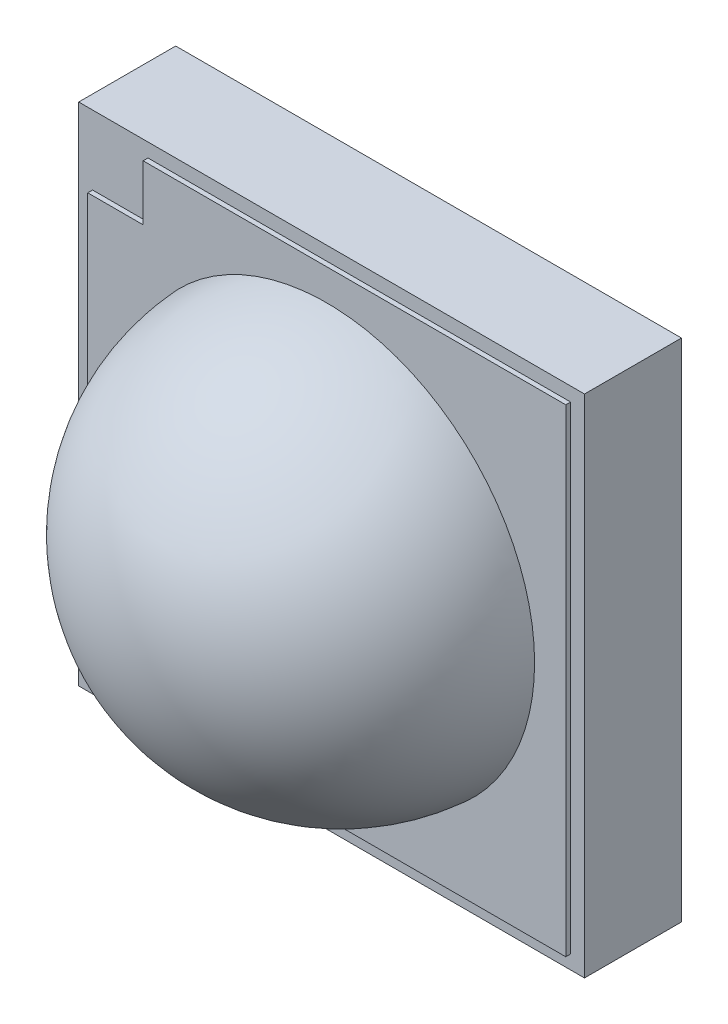
from build123d import *

# Parameters (mm, degrees)
EXTRUDE_1_DEPTH   = 0.035
SKETCH_1_W        = 0.53
SKETCH_1_H        = 0.75
EXTRUDE_1_2_DEPTH = 0.035
EXTRUDE_1_3_DEPTH = 0.035
EXTRUDE_1_4_DEPTH = 0.035
EXTRUDE_1_5_DEPTH = 0.035
EXTRUDE_1_6_DEPTH = 0.035
EXTRUDE_1_7_DEPTH = 0.035
SKETCH_2_W        = 3.65
SKETCH_2_H        = 3.65
EXTRUDE_2_DEPTH   = 0.7
EXTRUDE_3_DEPTH   = 0.035


with BuildPart() as part:
    # Эскиз1 → Бобышка-Вытянуть1 (new body)
    with BuildSketch(Plane.XY):
        Polygon((0.725, -1.625), (-0.525, -1.625), (-0.725, -1.425), (-0.725, 1.625), (0.725, 1.625), align=None)
    extrude(amount=EXTRUDE_1_DEPTH)



with BuildPart() as body_2:
    # Эскиз1 → Extrude 1 2 (new body)
    with BuildSketch(Plane.XY):
        with Locations((1.37, -1.25)):
            Rectangle(SKETCH_1_W, SKETCH_1_H)
    extrude(amount=EXTRUDE_1_2_DEPTH)


with BuildPart() as body_3:
    # Эскиз1 → Extrude 1 3 (new body)
    with BuildSketch(Plane.XY):
        with Locations((-1.37, -1.25)):
            Rectangle(SKETCH_1_W, SKETCH_1_H)
    extrude(amount=EXTRUDE_1_3_DEPTH)


with BuildPart() as body_4:
    # Эскиз1 → Extrude 1 4 (new body)
    with BuildSketch(Plane.XY):
        with Locations((1.37, 0)):
            Rectangle(SKETCH_1_W, SKETCH_1_H)
    extrude(amount=EXTRUDE_1_4_DEPTH)


with BuildPart() as body_5:
    # Эскиз1 → Extrude 1 5 (new body)
    with BuildSketch(Plane.XY):
        with Locations((1.37, 1.25)):
            Rectangle(SKETCH_1_W, SKETCH_1_H)
    extrude(amount=EXTRUDE_1_5_DEPTH)


with BuildPart() as body_6:
    # Эскиз1 → Extrude 1 6 (new body)
    with BuildSketch(Plane.XY):
        with Locations((-1.37, 0)):
            Rectangle(SKETCH_1_W, SKETCH_1_H)
    extrude(amount=EXTRUDE_1_6_DEPTH)


with BuildPart() as body_7:
    # Эскиз1 → Extrude 1 7 (new body)
    with BuildSketch(Plane.XY):
        with Locations((-1.37, 1.25)):
            Rectangle(SKETCH_1_W, SKETCH_1_H)
    extrude(amount=EXTRUDE_1_7_DEPTH)


with BuildPart() as part_1:
    add(part.part)

    add(body_2.part)  # Бобышка-Вытянуть2 merges body 2

    add(body_3.part)  # Бобышка-Вытянуть2 merges body 3

    add(body_4.part)  # Бобышка-Вытянуть2 merges body 4

    add(body_5.part)  # Бобышка-Вытянуть2 merges body 5

    add(body_6.part)  # Бобышка-Вытянуть2 merges body 6

    add(body_7.part)  # Бобышка-Вытянуть2 merges body 7
    # Эскиз2 → Бобышка-Вытянуть2 (add)
    with BuildSketch(Plane.XY.offset(0.035)):
        Rectangle(SKETCH_2_W, SKETCH_2_H)
    extrude(amount=EXTRUDE_2_DEPTH)

    # Эскиз4 → Бобышка-Вытянуть3 (add)
    with BuildSketch(Plane.XY.offset(0.735)):
        Polygon((1.725, 1.725), (1.725, -1.725), (-1.725, -1.725), (-1.725, 1.325), (-1.325, 1.325), (-1.325, 1.725), align=None)
    extrude(amount=EXTRUDE_3_DEPTH)


with BuildPart() as body_2_2:
    # Эскиз3 → Повернуть1 (revolve)
    with BuildSketch(Plane(origin=(0, 0, 0), x_dir=(1, 0, 0), z_dir=(0, 1, 0))):
        with BuildLine():
            Line((0, -0.77), (0, -2.17))
            ThreePointArc((0, -2.17), (-1.025914226, -1.765622385), (-1.5, -0.77))
            Line((-1.5, -0.77), (0, -0.77))
        make_face()
    revolve(axis=Axis((0, 0, 0.77), (0, 0, 1)))


solid = Compound([part_1.part, body_2_2.part])
